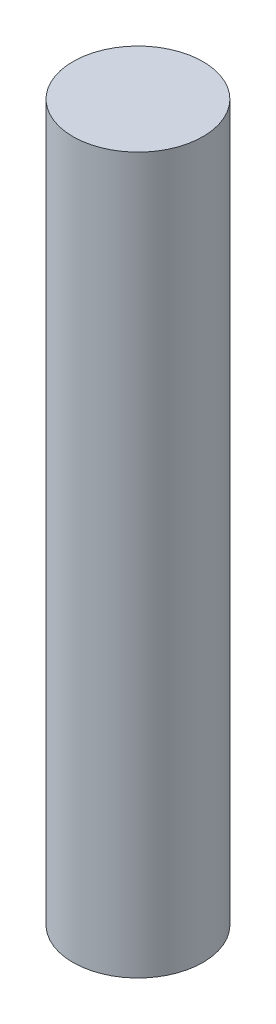
from build123d import *

# Parameters (mm, degrees)
SKETCH1_R           = 2
BOSS_EXTRUDE1_DEPTH = 22


with BuildPart() as part:
    # Sketch1 → Boss-Extrude1 (new body)
    with BuildSketch(Plane(origin=(0, 0, 0), x_dir=(1, 0, 0), z_dir=(0, 1, 0))):
        with Locations(Location((0, 0, 0), (0, 0, 270))):
            Circle(SKETCH1_R)
    extrude(amount=BOSS_EXTRUDE1_DEPTH)


solid = part.part
